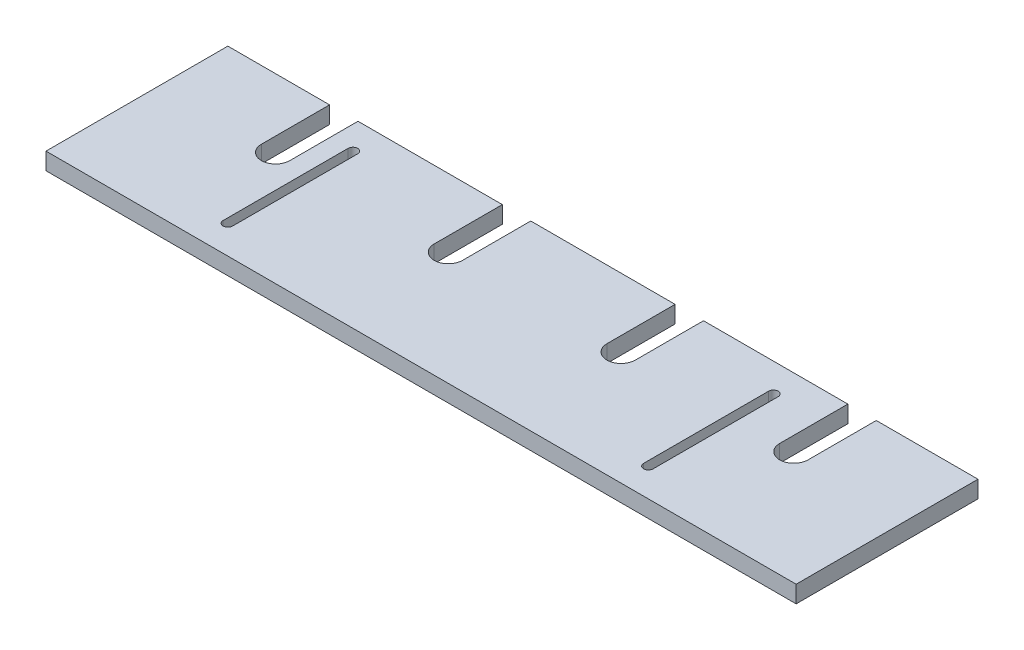
from build123d import *

# Parameters (mm, degrees)
SKETCH50_W          = 419.1
SKETCH50_H          = 101.6
BOSS_EXTRUDE4_DEPTH = 9.525
CUT_EXTRUDE7_REACH  = 217.83
CUT_EXTRUDE8_REACH  = 217.83


with BuildPart() as part:
    # Sketch50 → Boss-Extrude4 (new body)
    with BuildSketch(Plane(origin=(0, 0, 0), x_dir=(1, 0, 0), z_dir=(0, 1, 0))):
        Rectangle(SKETCH50_W, SKETCH50_H)
    extrude(amount=BOSS_EXTRUDE4_DEPTH)

    # Sketch51 → Cut-Extrude7 (cut, up to next)
    with BuildSketch(Plane.XZ, mode=Mode.PRIVATE) as cut_extrude7_sk1:
        with BuildLine():
            Line((152.7175, -12.7), (152.7175, -50.8))
            ThreePointArc((152.7175, -50.8), (144.78, -58.7375), (136.8425, -50.8))
            Line((136.8425, -50.8), (136.8425, -12.7))
            ThreePointArc((136.8425, -12.7), (144.78, -4.7625), (152.7175, -12.7))
        make_face()
    cut_extrude7_tool1 = extrude(cut_extrude7_sk1.sketch, amount=-CUT_EXTRUDE7_REACH, mode=Mode.PRIVATE) & part.part
    # Sketch51 → Cut-Extrude7 (cut, up to next)
    with BuildSketch(Plane.XZ, mode=Mode.PRIVATE) as cut_extrude7_sk2:
        with BuildLine():
            Line((40.3225, -50.8), (40.3225, -12.7))
            ThreePointArc((40.3225, -12.7), (48.26, -4.7625), (56.1975, -12.7))
            Line((56.1975, -12.7), (56.1975, -50.8))
            ThreePointArc((56.1975, -50.8), (48.26, -58.7375), (40.3225, -50.8))
        make_face()
    cut_extrude7_tool2 = extrude(cut_extrude7_sk2.sketch, amount=-CUT_EXTRUDE7_REACH, mode=Mode.PRIVATE) & part.part
    cut_extrude7_1 = cut_extrude7_tool1.solids().sort_by_distance((144.78, 0, -31.75))[0]
    add(cut_extrude7_1, mode=Mode.SUBTRACT)
    cut_extrude7_2 = cut_extrude7_tool2.solids().sort_by_distance((48.26, 0, -31.75))[0]
    add(cut_extrude7_2, mode=Mode.SUBTRACT)
    cut_extrude7 = cut_extrude7_1 + cut_extrude7_2  # Cut-Extrude7 as one shape, for the pattern or mirror that repeats it

    # Mirror4: Cut-Extrude7 across plane
    add(cut_extrude7.mirror(Plane(origin=(0, 0, 0), x_dir=(0, 0, 1), z_dir=(1, 0, 0))), mode=Mode.SUBTRACT)

    # Sketch55 → Cut-Extrude8 (cut, up to next)
    with BuildSketch(Plane.XZ, mode=Mode.PRIVATE) as cut_extrude8_sk1:
        with BuildLine():
            Line((-126.492, 34.925), (-126.492, -34.925))
            ThreePointArc((-126.492, -34.925), (-123.825, -37.592), (-121.158, -34.925))
            Line((-121.158, -34.925), (-121.158, 34.925))
            ThreePointArc((-121.158, 34.925), (-123.825, 37.592), (-126.492, 34.925))
        make_face()
    cut_extrude8_tool1 = extrude(cut_extrude8_sk1.sketch, amount=-CUT_EXTRUDE8_REACH, mode=Mode.PRIVATE) & part.part
    # Sketch55 → Cut-Extrude8 (cut, up to next)
    with BuildSketch(Plane.XZ, mode=Mode.PRIVATE) as cut_extrude8_sk2:
        with BuildLine():
            Line((108.458, 34.925), (108.458, -34.925))
            ThreePointArc((108.458, -34.925), (111.125, -37.592), (113.792, -34.925))
            Line((113.792, -34.925), (113.792, 34.925))
            ThreePointArc((113.792, 34.925), (111.125, 37.592), (108.458, 34.925))
        make_face()
    cut_extrude8_tool2 = extrude(cut_extrude8_sk2.sketch, amount=-CUT_EXTRUDE8_REACH, mode=Mode.PRIVATE) & part.part
    add(cut_extrude8_tool1.solids().sort_by_distance((-123.825, 0, 0))[0], mode=Mode.SUBTRACT)
    add(cut_extrude8_tool2.solids().sort_by_distance((111.125, 0, 0))[0], mode=Mode.SUBTRACT)


solid = part.part
